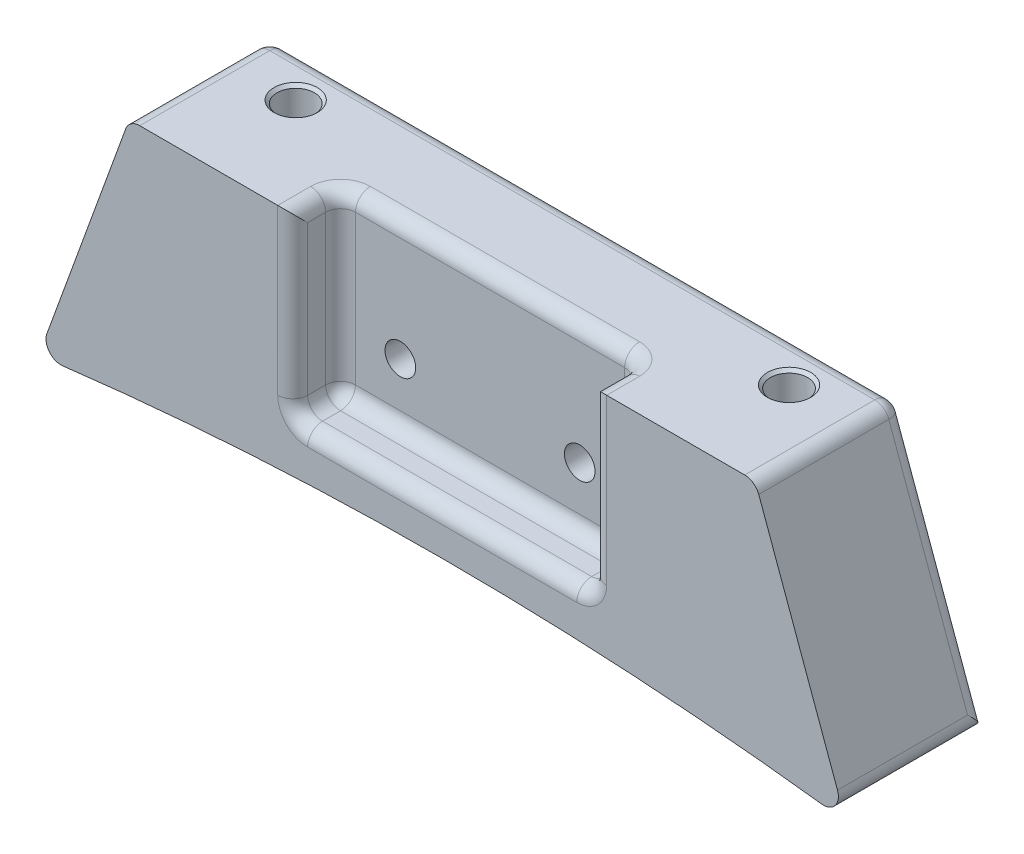
from build123d import *

# Parameters (mm, degrees)
SKETCH_1_R               = 0.5
EXTRUDE_1_DEPTH          = 9.7
HOLE_WIZARD_M3_1_D       = 2.5
HOLE_WIZARD_M3_1_DEPTH   = 7.5
HOLE_WIZARD_M3_1_TIP     = 0.751075774
CUT_EXTRUDE_2_DEPTH      = 33.35053134
CHAMFER_1_SIZE           = 0.5
CHAMFER_2_SIZE           = 0.2
SKETCH_11_W              = 20
SKETCH_11_H              = 12
CUT_EXTRUDE_3_DEPTH      = 3.2
FILLET_2_R               = 1
FILLET_3_R               = 1
HOLE_WIZARD_M2_5_3_D     = 2.05
HOLE_WIZARD_M2_5_3_DEPTH = 8.35
HOLE_WIZARD_M2_5_3_TIP   = 0.615882135


with BuildPart() as part:
    # 草图1 → 凸台-拉伸1 (new body)
    with BuildSketch(Plane.XY):
        with BuildLine():
            Line((-22, 14.94880858), (22, 14.94880858))
            Line((22, 14.94880858), (24.5, 14.94880858))
            Line((24.5, 14.94880858), (27, -1.742947298))
            ThreePointArc((27, -1.742947298), (0, 0), (-27, -1.742947298))
            Line((-27, -1.742947298), (-24.5, 14.94880858))
            Line((-24.5, 14.94880858), (-22, 14.94880858))
        make_face()
        with Locations((-6, 6.94880858)):
            Circle(SKETCH_1_R, mode=Mode.SUBTRACT)
        with Locations((6, 6.94880858)):
            Circle(SKETCH_1_R, mode=Mode.SUBTRACT)
    extrude(amount=EXTRUDE_1_DEPTH)

    # M3 螺纹孔1
    with Locations(Plane(origin=(0, 14.94880858, 0), x_dir=(-1, 0, 0), z_dir=(0, 1, 0))):
        with Locations((-16.5, 3), (16.5, 3)):
            Hole(HOLE_WIZARD_M3_1_D / 2, depth=HOLE_WIZARD_M3_1_DEPTH)
            with Locations((0, 0, -(HOLE_WIZARD_M3_1_DEPTH + HOLE_WIZARD_M3_1_TIP / 2))):  # 118° drill point
                Cone(0, HOLE_WIZARD_M3_1_D / 2, HOLE_WIZARD_M3_1_TIP, mode=Mode.SUBTRACT)

    # 草图10 → 切除-拉伸2 (cut, through all)
    with BuildSketch(Plane.XY.offset(9.7)):
        Polygon((27, -1.742947298), (20.914837438, 15.00313582), (24.5, 14.94880858), align=None)
    cut_extrude_2 = extrude(amount=-CUT_EXTRUDE_2_DEPTH, mode=Mode.SUBTRACT)

    # 镜向1: 切除-拉伸2 across plane
    add(cut_extrude_2.mirror(Plane(origin=(0, 0, 0), x_dir=(0, 0, 1), z_dir=(1, 0, 0))), mode=Mode.SUBTRACT)

    # 倒角1
    chamfer_1_edges = [part.edges().sort_by_distance(p)[0] for p in [
        (-6.5, 6.94880858, 0),
        (-6.5, 6.94880858, 9.7),
        (5.5, 6.94880858, 0),
        (5.5, 6.94880858, 9.7),
    ]]
    chamfer(chamfer_1_edges, length=CHAMFER_1_SIZE)

    # 倒角2
    chamfer_2_edges = [part.edges().sort_by_distance(p)[0] for p in [
        (-17.75, 14.94880858, 3),
        (15.25, 14.94880858, 3),
    ]]
    chamfer(chamfer_2_edges, length=CHAMFER_2_SIZE)

    # 草图11 → 切除-拉伸3 (cut)
    with BuildSketch(Plane.XY.offset(9.7)):
        with Locations((0, 8.94880858)):
            Rectangle(SKETCH_11_W, SKETCH_11_H)
    extrude(amount=-CUT_EXTRUDE_3_DEPTH, mode=Mode.SUBTRACT)

    # 圆角2
    fillet_2_edges = [part.edges().sort_by_distance(p)[0] for p in [
        (-10, 8.94880858, 6.5),
        (-10, 2.94880858, 8.1),
        (0, 14.94880858, 6.5),
        (-10, 14.94880858, 8.1),
        (10, 8.94880858, 6.5),
        (10, 14.94880858, 8.1),
        (0, 2.94880858, 6.5),
        (10, 2.94880858, 8.1),
        (-10, 8.94880858, 9.7),
        (0, 2.94880858, 9.7),
        (10, 8.94880858, 9.7),
    ]]
    fillet(fillet_2_edges, radius=FILLET_2_R)

    # 圆角3
    fillet_3_edges = [part.edges().sort_by_distance(p)[0] for p in [
        (27, -1.742947298, 4.85),
        (-27, -1.742947298, 4.85),
        (0, 14.94880858, 0),
        (20.934578776, 14.94880858, 4.85),
        (23.967289388, 6.602930641, 0),
        (-20.934578776, 14.94880858, 4.85),
        (-23.967289388, 6.602930641, 0),
    ]]
    fillet(fillet_3_edges, radius=FILLET_3_R)

    # M2.5 螺纹孔3
    with Locations(Plane(origin=(6, 6.94880858, 6.5), x_dir=(1, 0, 0), z_dir=(0, 0, 1))):
        with Locations((0, 0), (-12, 0)):
            Hole(HOLE_WIZARD_M2_5_3_D / 2, depth=HOLE_WIZARD_M2_5_3_DEPTH)
            with Locations((0, 0, -(HOLE_WIZARD_M2_5_3_DEPTH + HOLE_WIZARD_M2_5_3_TIP / 2))):  # 118° drill point
                Cone(0, HOLE_WIZARD_M2_5_3_D / 2, HOLE_WIZARD_M2_5_3_TIP, mode=Mode.SUBTRACT)


solid = part.part
